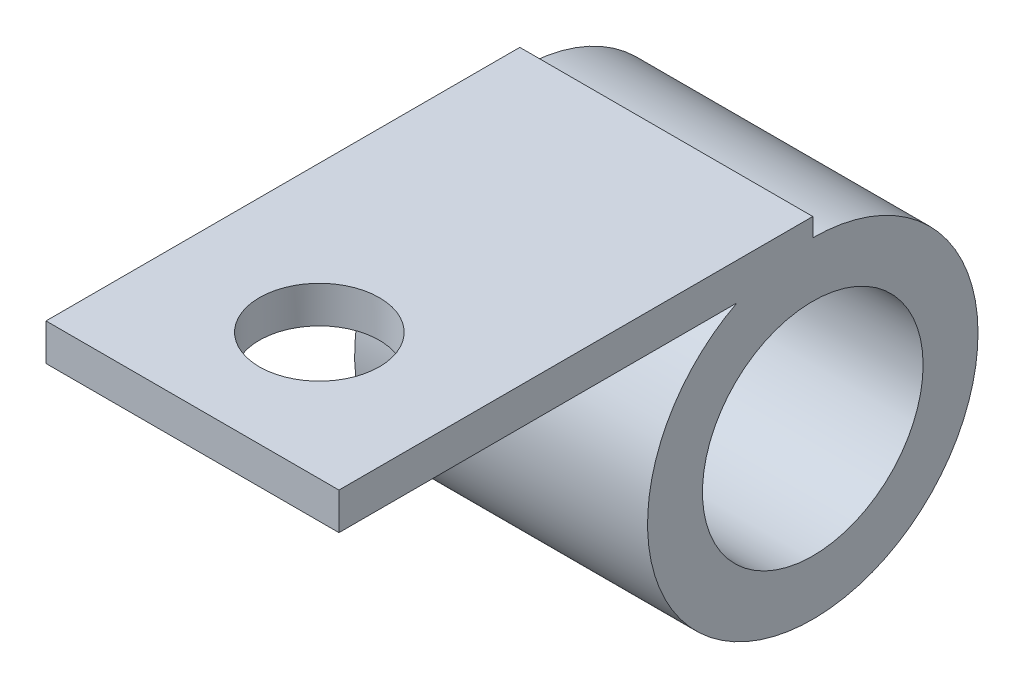
from build123d import *

# Parameters (mm, degrees)
LOOP_SKETCH_R       = 7.1625
LOOP_DEPTH          = 6.35
TAB_SKETCH_W        = 20.54
TAB_SKETCH_H        = 1.6
TAB_DEPTH           = 6.35
TUBE_HOLE_SKETCH_R  = 4.7825
TUBE_HOLE_DEPTH     = 7.35
MOUNT_HOLE_SKETCH_R = 2.6
MOUNT_HOLE_DEPTH    = 20


with BuildPart() as part:
    # Loop Sketch → Loop (new, symmetric)
    with BuildSketch(Plane(origin=(0, 0, 0), x_dir=(0, 0, -1), z_dir=(1, 0, 0))):
        Circle(LOOP_SKETCH_R)
    extrude(amount=LOOP_DEPTH, both=True)

    # Tab Sketch → Tab (add, symmetric)
    with BuildSketch(Plane(origin=(0, 0, 0), x_dir=(0, 0, -1), z_dir=(1, 0, 0))):
        with Locations((-10.27, 7.1625)):
            Rectangle(TAB_SKETCH_W, TAB_SKETCH_H)
    extrude(amount=TAB_DEPTH, both=True)

    # Tube Hole Sketch → Tube Hole (cut, symmetric)
    with BuildSketch(Plane(origin=(0, 0, 0), x_dir=(0, 0, -1), z_dir=(1, 0, 0))):
        Circle(TUBE_HOLE_SKETCH_R)
    extrude(amount=TUBE_HOLE_DEPTH, both=True, mode=Mode.SUBTRACT)

    # Mount Hole Sketch → Mount Hole (cut, symmetric)
    with BuildSketch(Plane(origin=(0, 0, 0), x_dir=(1, 0, 0), z_dir=(0, 1, 0))):
        with Locations((0, -15.04)):
            Circle(MOUNT_HOLE_SKETCH_R)
    extrude(amount=MOUNT_HOLE_DEPTH, both=True, mode=Mode.SUBTRACT)


solid = part.part
